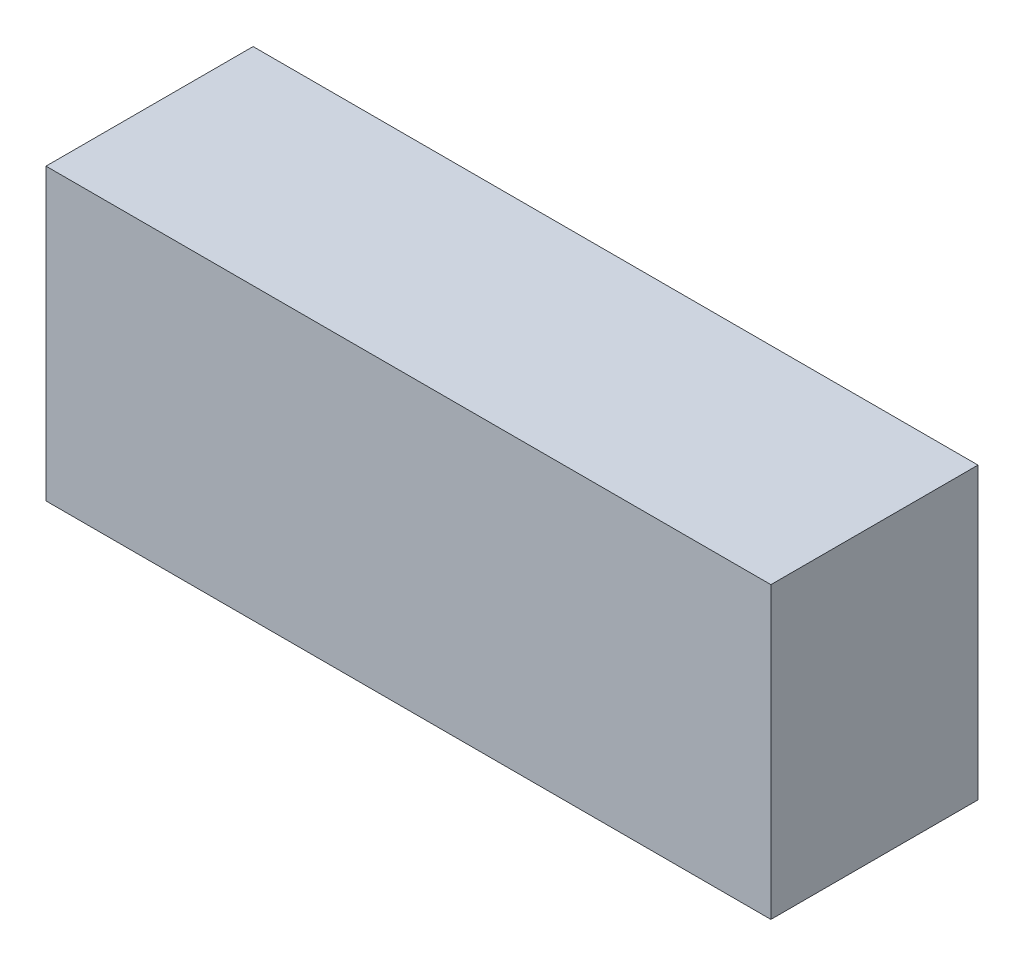
from build123d import *

# Parameters (mm, degrees)
SKETCH1_W                                  = 70
SKETCH1_H                                  = 28
REFERENCE_ENVELOPE_NOT_MANUFACTURING_DEPTH = 20


with BuildPart() as part:
    # Sketch1 → REFERENCE_ENVELOPE_NOT_MANUFACTURING (new body)
    with BuildSketch(Plane.XY):
        Rectangle(SKETCH1_W, SKETCH1_H)
    extrude(amount=REFERENCE_ENVELOPE_NOT_MANUFACTURING_DEPTH)


solid = part.part
